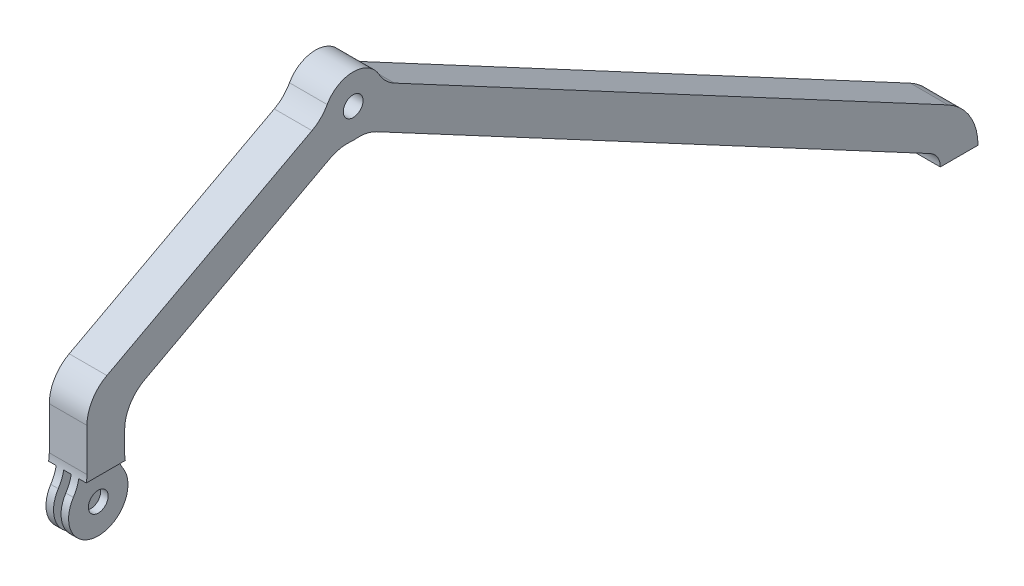
from build123d import *

# Parameters (mm, degrees)
SKETCH3_W           = 38.1
SKETCH3_H           = 38.1
SKETCH4_R           = 10
CUT_EXTRUDE1_DEPTH  = 917.183483622
SKETCH5_R           = 30
SKETCH5_R_2         = 10
BOSS_EXTRUDE1_DEPTH = 38.1
FILLET1_R           = 38.1
SKETCH6_W           = 7.62
SKETCH6_H           = 80.541178389
CUT_EXTRUDE2_DEPTH  = 60


with BuildPart() as part:
    # Sweep1: sweep along a path in Sketch1
    with BuildLine(Plane(origin=(0, 0, 0), x_dir=(0, 0, -1), z_dir=(1, 0, 0))) as sweep1_path:
        Line((0, 0), (0, 91.466893968))
        Line((0, 91.466893968), (250, 225))
        Line((250, 225), (842.350315886, -91.393510157))
        ThreePointArc((842.350315886, -91.393510157), (857.076574448, -105.407871929), (862.5, -125))
    # Sketch3 → Sweep1 (sweep)
    with BuildSketch(Plane(origin=(0, 0, 0), x_dir=(1, 0, 0), z_dir=(0, 1, 0))):
        Rectangle(SKETCH3_W, SKETCH3_H)
    sweep(path=sweep1_path.line, transition=Transition.RIGHT)

    # Sketch4 → Cut-Extrude1 (cut, through all)
    with BuildSketch(Plane(origin=(19.05, 0, 0), x_dir=(0, 0, -1), z_dir=(1, 0, 0))):
        Circle(SKETCH4_R)
        with Locations((250, 225)):
            Circle(SKETCH4_R)
    extrude(amount=-CUT_EXTRUDE1_DEPTH, mode=Mode.SUBTRACT)

    # Sketch5 → Boss-Extrude1 (add)
    # profile 1 of 2: a face of its own
    with BuildSketch(Plane(origin=(19.05, 0, 0), x_dir=(0, 0, -1), z_dir=(1, 0, 0))):
        Circle(SKETCH5_R)
        Circle(SKETCH5_R_2, mode=Mode.SUBTRACT)
    # profile 2 of 2: a face of its own
    with BuildSketch(Plane(origin=(19.05, 0, 0), x_dir=(0, 0, -1), z_dir=(1, 0, 0))):
        with Locations((250, 225)):
            Circle(SKETCH5_R)
        with Locations((250, 225)):
            Circle(SKETCH5_R_2, mode=Mode.SUBTRACT)
    extrude(amount=-BOSS_EXTRUDE1_DEPTH)

    # Fillet1
    fillet1_edges = [part.edges().sort_by_distance(p)[0] for p in [
        (0, 230.884475737, -279.417221917),
        (0, 197.277985894, -261.46690603),
        (0, 80.044948857, -19.05),
        (0, 102.888839079, 19.05),
        (0, 23.175364075, 19.05),
        (0, 23.175364075, -19.05),
        (0, 230.884475737, -220.582778083),
        (0, 197.277985894, -238.53309397),
    ]]
    fillet(fillet1_edges, radius=FILLET1_R)

    # Sketch6 → Cut-Extrude2 (cut)
    with BuildSketch(Plane(origin=(0, -30, 0), x_dir=(-1, 0, 0), z_dir=(0, -1, 0))):
        with Locations((-15.24, -3.428675544)):
            Rectangle(SKETCH6_W, SKETCH6_H)
        with Locations((0, -3.428675544)):
            Rectangle(SKETCH6_W, SKETCH6_H)
        with Locations((15.24, -3.428675544)):
            Rectangle(SKETCH6_W, SKETCH6_H)
    extrude(amount=-CUT_EXTRUDE2_DEPTH, mode=Mode.SUBTRACT)


solid = part.part
